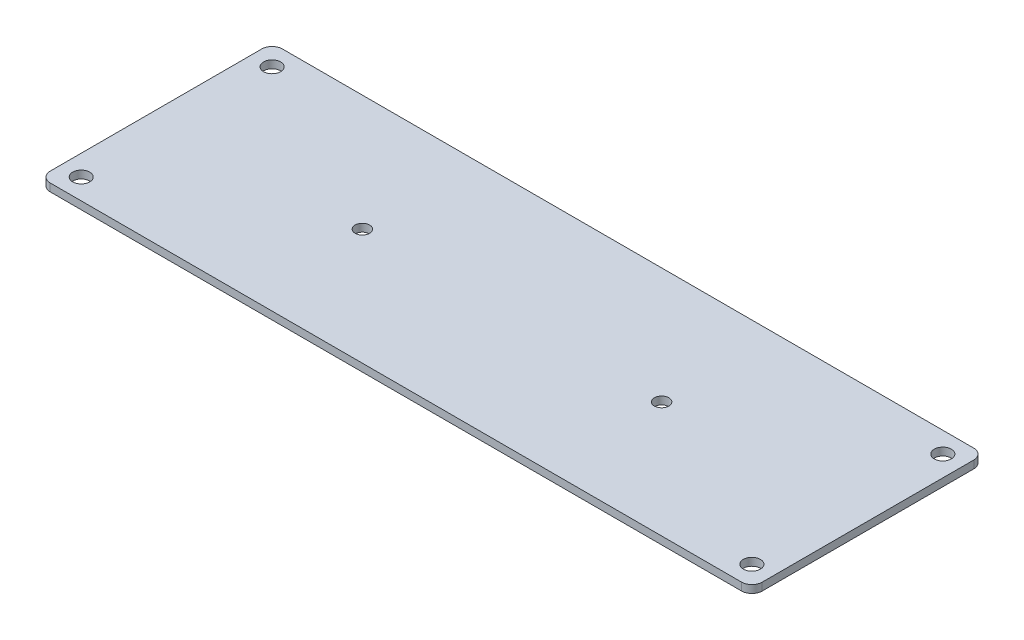
from build123d import *

# Parameters (mm, degrees)
SKETCH1_W           = 138
SKETCH1_H           = 45
SKETCH1_R           = 1.4
BOSS_EXTRUDE1_DEPTH = 1.5
SKETCH2_R           = 1.65
CUT_EXTRUDE1_DEPTH  = 73.591321795
FILLET1_R           = 2


with BuildPart() as part:
    # Sketch1 → Boss-Extrude1 (new body)
    with BuildSketch(Plane(origin=(0, 0, 0), x_dir=(1, 0, 0), z_dir=(0, 1, 0))):
        Rectangle(SKETCH1_W, SKETCH1_H)
        with Locations(Location((-29, 0, 0), (0, 0, 270))):
            Circle(SKETCH1_R, mode=Mode.SUBTRACT)
        with Locations(Location((29, 0, 0), (0, 0, 270))):
            Circle(SKETCH1_R, mode=Mode.SUBTRACT)
    extrude(amount=BOSS_EXTRUDE1_DEPTH)

    # Sketch2 → Cut-Extrude1 (cut, through all)
    with BuildSketch(Plane(origin=(0, 1.5, 0), x_dir=(1, 0, 0), z_dir=(0, 1, 0))):
        with Locations(Location((-65, 18.5, 0), (0, 0, 270))):
            Circle(SKETCH2_R)
        with Locations(Location((-65, -18.5, 0), (0, 0, 270))):
            Circle(SKETCH2_R)
        with Locations(Location((65, 18.5, 0), (0, 0, 270))):
            Circle(SKETCH2_R)
        with Locations(Location((65, -18.5, 0), (0, 0, 270))):
            Circle(SKETCH2_R)
    extrude(amount=-CUT_EXTRUDE1_DEPTH, mode=Mode.SUBTRACT)

    # Fillet1
    fillet1_edges = [part.edges().sort_by_distance(p)[0] for p in [
        (-69, 0.75, -22.5),
        (69, 0.75, -22.5),
        (69, 0.75, 22.5),
        (-69, 0.75, 22.5),
    ]]
    fillet(fillet1_edges, radius=FILLET1_R)


solid = part.part
